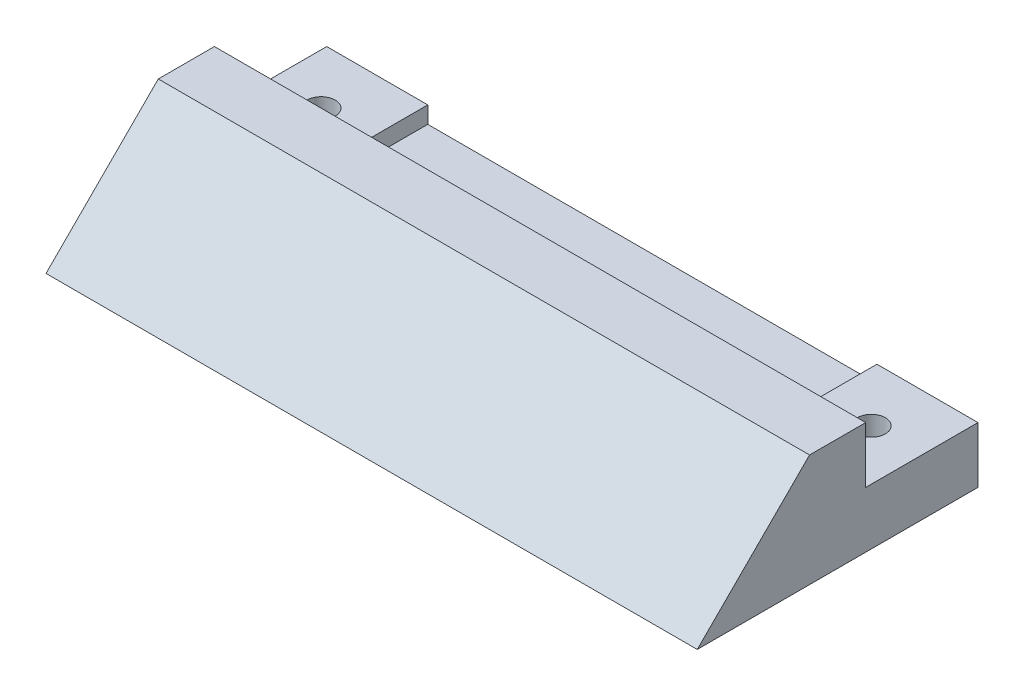
from build123d import *

# Parameters (mm, degrees)
BOSS_EXTRUDE1_DEPTH = 58
SKETCH3_W           = 40
SKETCH3_H           = 10
CUT_EXTRUDE2_DEPTH  = 6.5
CUT_EXTRUDE3_REACH  = 65.492
SKETCH4_R           = 1.25
SKETCH5_W           = 58
SKETCH5_H           = 10
CUT_EXTRUDE4_DEPTH  = 5
CUT_EXTRUDE5_REACH  = 65.356
SKETCH6_R           = 1.25
FILLET1_R           = 3


with BuildPart() as part:
    # Sketch1 → Boss-Extrude1 (new body)
    with BuildSketch(Plane(origin=(0, 0, 0), x_dir=(0, 0, -1), z_dir=(1, 0, 0))):
        Polygon((0, 0), (10, 10), (25, 10), (25, 0), align=None)
    extrude(amount=BOSS_EXTRUDE1_DEPTH)

    # Sketch3 → Cut-Extrude2 (cut)
    with BuildSketch(Plane(origin=(0, 10, 0), x_dir=(1, 0, 0), z_dir=(0, 1, 0))):
        with Locations((29, 20)):
            Rectangle(SKETCH3_W, SKETCH3_H)
    extrude(amount=-CUT_EXTRUDE2_DEPTH, mode=Mode.SUBTRACT)

    # Sketch4 → Cut-Extrude3 (cut, up to next)
    with BuildSketch(Plane(origin=(0, 3.5, 0), x_dir=(1, 0, 0), z_dir=(0, 1, 0)), mode=Mode.PRIVATE) as cut_extrude3_sk1:
        with Locations(Location((14, 20, 0), (0, 0, 270))):
            Circle(SKETCH4_R)
    cut_extrude3_tool1 = extrude(cut_extrude3_sk1.sketch, amount=-CUT_EXTRUDE3_REACH, mode=Mode.PRIVATE) & part.part
    # Sketch4 → Cut-Extrude3 (cut, up to next)
    with BuildSketch(Plane(origin=(0, 3.5, 0), x_dir=(1, 0, 0), z_dir=(0, 1, 0)), mode=Mode.PRIVATE) as cut_extrude3_sk2:
        with Locations(Location((29, 20, 0), (0, 0, 270))):
            Circle(SKETCH4_R)
    cut_extrude3_tool2 = extrude(cut_extrude3_sk2.sketch, amount=-CUT_EXTRUDE3_REACH, mode=Mode.PRIVATE) & part.part
    # Sketch4 → Cut-Extrude3 (cut, up to next)
    with BuildSketch(Plane(origin=(0, 3.5, 0), x_dir=(1, 0, 0), z_dir=(0, 1, 0)), mode=Mode.PRIVATE) as cut_extrude3_sk3:
        with Locations(Location((44, 20, 0), (0, 0, 270))):
            Circle(SKETCH4_R)
    cut_extrude3_tool3 = extrude(cut_extrude3_sk3.sketch, amount=-CUT_EXTRUDE3_REACH, mode=Mode.PRIVATE) & part.part
    add(cut_extrude3_tool1.solids().sort_by_distance((14, 3.5, -20))[0], mode=Mode.SUBTRACT)
    add(cut_extrude3_tool2.solids().sort_by_distance((29, 3.5, -20))[0], mode=Mode.SUBTRACT)
    add(cut_extrude3_tool3.solids().sort_by_distance((44, 3.5, -20))[0], mode=Mode.SUBTRACT)

    # Sketch5 → Cut-Extrude4 (cut)
    with BuildSketch(Plane(origin=(0, 10, 0), x_dir=(1, 0, 0), z_dir=(0, 1, 0))):
        with Locations((29, 20)):
            Rectangle(SKETCH5_W, SKETCH5_H)
    extrude(amount=-CUT_EXTRUDE4_DEPTH, mode=Mode.SUBTRACT)

    # Sketch6 → Cut-Extrude5 (cut, up to next)
    with BuildSketch(Plane(origin=(0, 5, 0), x_dir=(1, 0, 0), z_dir=(0, 1, 0)), mode=Mode.PRIVATE) as cut_extrude5_sk1:
        with Locations(Location((4.5, 20, 0), (0, 0, 270))):
            Circle(SKETCH6_R)
    cut_extrude5_tool1 = extrude(cut_extrude5_sk1.sketch, amount=-CUT_EXTRUDE5_REACH, mode=Mode.PRIVATE) & part.part
    # Sketch6 → Cut-Extrude5 (cut, up to next)
    with BuildSketch(Plane(origin=(0, 5, 0), x_dir=(1, 0, 0), z_dir=(0, 1, 0)), mode=Mode.PRIVATE) as cut_extrude5_sk2:
        with Locations(Location((53.5, 20, 0), (0, 0, 270))):
            Circle(SKETCH6_R)
    cut_extrude5_tool2 = extrude(cut_extrude5_sk2.sketch, amount=-CUT_EXTRUDE5_REACH, mode=Mode.PRIVATE) & part.part
    add(cut_extrude5_tool1.solids().sort_by_distance((4.5, 5, -20))[0], mode=Mode.SUBTRACT)
    add(cut_extrude5_tool2.solids().sort_by_distance((53.5, 5, -20))[0], mode=Mode.SUBTRACT)

    # Fillet1
    fillet1_edges = [part.edges().sort_by_distance(p)[0] for p in [
        (9, 4.25, -15),
        (49, 4.25, -15),
    ]]
    fillet(fillet1_edges, radius=FILLET1_R)


solid = part.part
